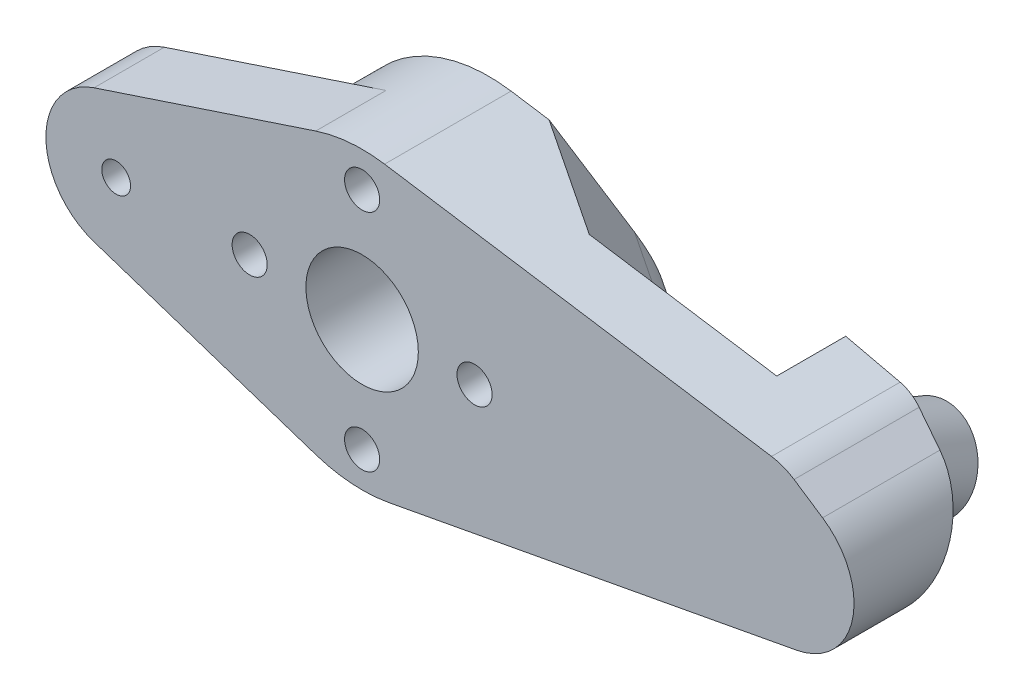
from build123d import *
from OCP.BRepFilletAPI import BRepFilletAPI_MakeChamfer

# Parameters (mm, degrees)
BOSS_EXTRU_1_DEPTH                  = 10
ENL_V_MAT_EXTRU_1_REACH             = 39.885
ESQUISSE2_R                         = 4
ESQUISSE2_R_2                       = 1.25
ENL_V_MAT_EXTRU_2_REACH             = 39.885
ENL_V_MAT_EXTRU_2_DIRECTION_2_REACH = 39.885
BOSS_EXTRU_2_START                  = 2
BOSS_EXTRU_2_DEPTH                  = 2
ENL_V_MAT_EXTRU_3_REACH             = 40.347
ESQUISSE7_R                         = 1.25
ENL_V_MAT_EXTRU_4_DEPTH             = 6
ESQUISSE8_W                         = 13.848155074
ESQUISSE8_H                         = 21.741024256
ENL_V_MAT_EXTRU_5_DEPTH             = 2.4
BOSS_EXTRU_3_START                  = 3
ESQUISSE9_R                         = 3.222512383
ESQUISSE9_R_2                       = 1.25
BOSS_EXTRU_3_DEPTH                  = 3
CHANFREIN1_SIZE                     = 4
CHANFREIN1_SIZE2                    = 4.360122539
CHANFREIN1_SIZE2_2                  = 4.445329843
CONG_1_R                            = 4
ESQUISSE10_R                        = 15.601739672
ENL_V_MAT_EXTRU_6_DEPTH             = 1
BOSS_EXTRU_5_START                  = -5
ESQUISSE13_R                        = 1.025
BOSS_EXTRU_5_DEPTH                  = 5
ENL_V_MAT_EXTRU_7_DEPTH             = 1.5


with BuildPart() as part:
    # Esquisse1 → Boss.-Extru.1 (new body)
    with BuildSketch(Plane.XY):
        with BuildLine():
            Line((30.916666667, -4.915254034), (1.925, -10.322033472))
            ThreePointArc((1.925, -10.322033472), (-10.498702111, -0.165087796), (1.599509013, 10.377454934))
            Line((1.599509013, 10.377454934), (30, 6))
            Line((30, 6), (32.763853992, 4.166666667))
            ThreePointArc((32.763853992, 4.166666667), (34.899681519, -0.996554572), (30.916666667, -4.915254034))
        make_face()
    extrude(amount=BOSS_EXTRU_1_DEPTH)

    # Esquisse2 → Enlèv. mat.-Extru.1 (cut, up to next)
    with BuildSketch(Plane.XY.offset(10), mode=Mode.PRIVATE) as enl_v_mat_extru_1_sk1:
        Circle(ESQUISSE2_R)
    enl_v_mat_extru_1_tool1 = extrude(enl_v_mat_extru_1_sk1.sketch, amount=-ENL_V_MAT_EXTRU_1_REACH, mode=Mode.PRIVATE) & part.part
    # Esquisse2 → Enlèv. mat.-Extru.1 (cut, up to next)
    with BuildSketch(Plane.XY.offset(10), mode=Mode.PRIVATE) as enl_v_mat_extru_1_sk2:
        with Locations((0, 8)):
            Circle(ESQUISSE2_R_2)
    enl_v_mat_extru_1_tool2 = extrude(enl_v_mat_extru_1_sk2.sketch, amount=-ENL_V_MAT_EXTRU_1_REACH, mode=Mode.PRIVATE) & part.part
    # Esquisse2 → Enlèv. mat.-Extru.1 (cut, up to next)
    with BuildSketch(Plane.XY.offset(10), mode=Mode.PRIVATE) as enl_v_mat_extru_1_sk3:
        with Locations((8, 0)):
            Circle(ESQUISSE2_R_2)
    enl_v_mat_extru_1_tool3 = extrude(enl_v_mat_extru_1_sk3.sketch, amount=-ENL_V_MAT_EXTRU_1_REACH, mode=Mode.PRIVATE) & part.part
    # Esquisse2 → Enlèv. mat.-Extru.1 (cut, up to next)
    with BuildSketch(Plane.XY.offset(10), mode=Mode.PRIVATE) as enl_v_mat_extru_1_sk4:
        with Locations((0, -8)):
            Circle(ESQUISSE2_R_2)
    enl_v_mat_extru_1_tool4 = extrude(enl_v_mat_extru_1_sk4.sketch, amount=-ENL_V_MAT_EXTRU_1_REACH, mode=Mode.PRIVATE) & part.part
    # Esquisse2 → Enlèv. mat.-Extru.1 (cut, up to next)
    with BuildSketch(Plane.XY.offset(10), mode=Mode.PRIVATE) as enl_v_mat_extru_1_sk5:
        with Locations((-8, 0)):
            Circle(ESQUISSE2_R_2)
    enl_v_mat_extru_1_tool5 = extrude(enl_v_mat_extru_1_sk5.sketch, amount=-ENL_V_MAT_EXTRU_1_REACH, mode=Mode.PRIVATE) & part.part
    add(enl_v_mat_extru_1_tool1.solids().sort_by_distance((0, 0, 10))[0], mode=Mode.SUBTRACT)
    add(enl_v_mat_extru_1_tool2.solids().sort_by_distance((0, 8, 10))[0], mode=Mode.SUBTRACT)
    add(enl_v_mat_extru_1_tool3.solids().sort_by_distance((8, 0, 10))[0], mode=Mode.SUBTRACT)
    add(enl_v_mat_extru_1_tool4.solids().sort_by_distance((0, -8, 10))[0], mode=Mode.SUBTRACT)
    add(enl_v_mat_extru_1_tool5.solids().sort_by_distance((-8, 0, 10))[0], mode=Mode.SUBTRACT)

    # Enlèv. mat.-Extru.2: up to this plane
    enl_v_mat_extru_2_end = Plane(origin=(30.916666667, -4.915254034, 10), z_dir=(-0.18333333333333338, 0.9830508068705753, 0))
    # Esquisse4 → Enlèv. mat.-Extru.2 (cut, up to the surface)
    with BuildSketch(Plane(origin=(0, 0, 0), x_dir=(1, 0, 0), z_dir=(0, 1, 0)), mode=Mode.PRIVATE) as enl_v_mat_extru_2_sk1:
        Polygon((20, -5.5), (25, -5.5), (25, 0), (11, 0), align=None)
    enl_v_mat_extru_2_tool1 = split(extrude(enl_v_mat_extru_2_sk1.sketch, amount=-ENL_V_MAT_EXTRU_2_REACH, mode=Mode.PRIVATE), bisect_by=enl_v_mat_extru_2_end, keep=Keep.BOTH, mode=Mode.PRIVATE)
    add(enl_v_mat_extru_2_tool1.solids().sort_by_distance((19.894737, 0, 2.315789))[0], mode=Mode.SUBTRACT)

    # Enlèv. mat.-Extru.2 direction 2: up to this plane
    enl_v_mat_extru_2_direction_2_end = Plane(origin=(1.599509013, 10.377454934, 10), z_dir=(-0.15233419172434606, -0.98832904137827, 0))
    # Esquisse4 → Enlèv. mat.-Extru.2 direction 2 (cut, up to the surface)
    with BuildSketch(Plane(origin=(0, 0, 0), x_dir=(1, 0, 0), z_dir=(0, 1, 0)), mode=Mode.PRIVATE) as enl_v_mat_extru_2_direction_2_sk1:
        Polygon((20, -5.5), (25, -5.5), (25, 0), (11, 0), align=None)
    enl_v_mat_extru_2_direction_2_tool1 = split(extrude(enl_v_mat_extru_2_direction_2_sk1.sketch, amount=ENL_V_MAT_EXTRU_2_DIRECTION_2_REACH, mode=Mode.PRIVATE), bisect_by=enl_v_mat_extru_2_direction_2_end, keep=Keep.BOTH, mode=Mode.PRIVATE)
    add(enl_v_mat_extru_2_direction_2_tool1.solids().sort_by_distance((19.894737, 0, 2.315789))[0], mode=Mode.SUBTRACT)

    # Esquisse5 → Boss.-Extru.2 (add)
    with BuildSketch(Plane(origin=(0, 0, 0), x_dir=(-1, 0, 0), z_dir=(0, 0, -1)).offset(BOSS_EXTRU_2_START)):
        with BuildLine():
            Line((-25, -6.018678409), (-25, 6.770665362))
            Line((-25, 6.770665362), (-30, 6))
            Line((-30, 6), (-32.763853992, 4.166666667))
            ThreePointArc((-32.763853992, 4.166666667), (-34.899681519, -0.996554572), (-30.916666667, -4.915254034))
            Line((-30.916666667, -4.915254034), (-25, -6.018678409))
        make_face()
    extrude(amount=-BOSS_EXTRU_2_DEPTH)

    # Esquisse6 → Enlèv. mat.-Extru.3 (cut, up to next)
    with BuildSketch(Plane.ZY.offset(-25), mode=Mode.PRIVATE) as enl_v_mat_extru_3_sk1:
        Polygon((-2, 6.770665362), (3.214027448, -6.018678409), (-2, -6.018678409), align=None)
    enl_v_mat_extru_3_tool1 = extrude(enl_v_mat_extru_3_sk1.sketch, amount=-ENL_V_MAT_EXTRU_3_REACH, mode=Mode.PRIVATE) & part.part
    add(enl_v_mat_extru_3_tool1.solids().sort_by_distance((25, -1.755564, -0.261991))[0], mode=Mode.SUBTRACT)

    # Esquisse7 → Enlèv. mat.-Extru.4 (cut)
    with BuildSketch(Plane(origin=(0, 0.265787595, 0.651943042), x_dir=(-1, 0, 0), z_dir=(0, -0.3775175740026018, -0.9260024197156237))):
        with Locations(Location((-30, 1.25, 0), (0, 0, 90))):
            Circle(ESQUISSE7_R)
    extrude(amount=-ENL_V_MAT_EXTRU_4_DEPTH, mode=Mode.SUBTRACT)

    # Esquisse8 → Enlèv. mat.-Extru.5 (cut)
    with BuildSketch(Plane(origin=(0, 0.265787595, 0.651943042), x_dir=(-1, 0, 0), z_dir=(0, -0.3775175740026018, -0.9260024197156237))):
        with Locations((-31.924077537, 0.043327094)):
            Rectangle(ESQUISSE8_W, ESQUISSE8_H)
    extrude(amount=-ENL_V_MAT_EXTRU_5_DEPTH, mode=Mode.SUBTRACT)

    # Esquisse9 → Boss.-Extru.3 (add)
    with BuildSketch(Plane(origin=(0, 1.171829772, 2.87434885), x_dir=(-1, 0, 0), z_dir=(0, -0.37751757400260183, -0.9260024197156237)).offset(BOSS_EXTRU_3_START)):
        with Locations(Location((-30, 1.25, 0), (0, 0, 125.615228438))):
            Circle(ESQUISSE9_R)
        with Locations(Location((-30, 1.25, 0), (0, 0, 90))):
            Circle(ESQUISSE9_R_2, mode=Mode.SUBTRACT)
    extrude(amount=-BOSS_EXTRU_3_DEPTH)

    # Chanfrein1: one chamfer whose edges measure the first distance from different faces: ONE call of the kernel's chamfer builder (chamfer() names one face for all edges)
    chanfrein1_edges_1 = [part.edges().sort_by_distance(p)[0] for p in [
        (15.5, 8.23492955, 2.75),
    ]]
    chanfrein1_side_1 = [part.faces().sort_by_distance(p)[0] for p in [
        (15.356524745, 0.219956318, 2.662320677),
    ]]
    chanfrein1_edges_2 = [part.edges().sort_by_distance(p)[0] for p in [
        (15.5, -7.790373885, 2.75),
    ]]
    chanfrein1_side_2 = [part.faces().sort_by_distance(p)[0] for p in [
        (13.6786873, -8.13003825, 6.041602489),
    ]]
    chanfrein1 = BRepFilletAPI_MakeChamfer(part.part.solid().wrapped)
    for e in chanfrein1_edges_1:
        chanfrein1.Add(CHANFREIN1_SIZE, CHANFREIN1_SIZE2, e.wrapped, chanfrein1_side_1[0].wrapped)  # the first distance lies on this face
    for e in chanfrein1_edges_2:
        chanfrein1.Add(CHANFREIN1_SIZE, CHANFREIN1_SIZE2_2, e.wrapped, chanfrein1_side_2[0].wrapped)  # the first distance lies on this face
    add(Compound.cast(chanfrein1.Shape()), mode=Mode.REPLACE)

    # Congé1
    cong_1_edges = [part.edges().sort_by_distance(p)[0] for p in [
        (15.5, -3.289111279, 2.75),
        (15.5, 4.200483399, 2.75),
        (30, 6, 5.452987412),
    ]]
    fillet(cong_1_edges, radius=CONG_1_R)

    # Esquisse10 → Enlèv. mat.-Extru.6 (cut)
    with BuildSketch(Plane(origin=(0, 0, 0), x_dir=(-1, 0, 0), z_dir=(0, 0, -1))):
        Circle(ESQUISSE10_R)
    extrude(amount=-ENL_V_MAT_EXTRU_6_DEPTH, mode=Mode.SUBTRACT)

    # Esquisse13 → Boss.-Extru.5 (add)
    with BuildSketch(Plane.XY.offset(10).offset(BOSS_EXTRU_5_START)):
        with BuildLine():
            Line((-3.3, -9.967948636), (-19.071428571, -4.746642207))
            ThreePointArc((-19.071428571, -4.746642207), (-22.5, 0), (-19.071428571, 4.746642207))
            Line((-19.071428571, 4.746642207), (-3.3, 9.967948636))
            ThreePointArc((-3.3, 9.967948636), (-10.5, 0), (-3.3, -9.967948636))
        make_face()
        with Locations((-17.5, 0)):
            Circle(ESQUISSE13_R, mode=Mode.SUBTRACT)
    extrude(amount=BOSS_EXTRU_5_DEPTH)

    # Esquisse14 → Enlèv. mat.-Extru.7 (cut)
    with BuildSketch(Plane(origin=(-3.3, -9.967948636, 0), x_dir=(0.9493284414763515, -0.3142857142857143, 0), z_dir=(-0.3142857142857143, -0.9493284414763515, 0))):
        Polygon((-14.932458463, 9.25), (-14.280415194, 9.25), (-13.481837469, 6.80869391), (-12.677650771, 9.25), (-12.031917598, 9.25), (-11.440170803, 5.75), (-12.076088271, 5.75), (-12.449786187, 7.960637019), (-13.17755061, 5.75), (-13.790331059, 5.75), (-14.513888751, 7.960637019), (-14.886885546, 5.75), (-15.523504136, 5.75), align=None)
        with BuildLine():
            Line((-10.452991316, 8.083333333), (-11.081196444, 8.083333333))
            add(Edge.make_bspline(
                [(-11.081196444, 8.083333333), (-11.078483322, 8.130853728), (-11.073182045, 8.223705726), (-11.052094907, 8.358576225), (-11.023838864, 8.486014017), (-10.986127424, 8.605573308), (-10.938740533, 8.717210656), (-10.882897577, 8.821306638), (-10.817171895, 8.917313186), (-10.742962345, 9.004767303), (-10.661528803, 9.083223199), (-10.574561909, 9.152787125), (-10.480731385, 9.210189525), (-10.381751594, 9.257426387), (-10.277639389, 9.295166444), (-10.167409705, 9.320398727), (-10.05201697, 9.337486275), (-9.973021299, 9.338981504), (-9.932758944, 9.33974359)],
                knots=[0, 0, 0, 0, 1.199038563, 2.342849363, 3.436047546, 4.486744587, 5.497670872, 6.488682221, 7.459191391, 8.424610317, 9.374430501, 10.305433194, 11.225809216, 12.140057399, 13.06607119, 14.010487599, 14.985989317, 16, 16, 16, 16], degree=3))
            add(Edge.make_bspline(
                [(-9.932758944, 9.33974359), (-9.883337474, 9.33820151), (-9.786855184, 9.335191008), (-9.646658763, 9.309510428), (-9.515730635, 9.266555691), (-9.394165971, 9.206536594), (-9.282999674, 9.130288623), (-9.182250177, 9.039375396), (-9.094964306, 8.931889507), (-9.020588643, 8.812303267), (-8.958791357, 8.68567827), (-8.915486392, 8.554742772), (-8.887022505, 8.42297127), (-8.883986656, 8.334243011), (-8.882478495, 8.290164263)],
                knots=[0, 0, 0, 0, 1.075374347, 2.099382735, 3.09057751, 4.06680945, 5.040638231, 6.016817125, 7.011024321, 8.044445721, 9.0776792, 10.070479129, 11.0414456, 12, 12, 12, 12], degree=3))
            add(Edge.make_bspline(
                [(-8.882478495, 8.290164263), (-8.883065693, 8.263502321), (-8.884247578, 8.209838418), (-8.892465378, 8.128631761), (-8.904793703, 8.045913287), (-8.923381813, 7.961753919), (-8.94656271, 7.876130065), (-8.974684488, 7.788785484), (-9.00839946, 7.700215386), (-9.047144991, 7.609422931), (-9.093368508, 7.516113351), (-9.147189369, 7.418887899), (-9.210036101, 7.317832821), (-9.281149594, 7.212377529), (-9.360875231, 7.10268834), (-9.449602205, 6.989095673), (-9.546308589, 6.871199265), (-9.614943831, 6.792392132), (-9.65020686, 6.751903045)],
                knots=[0, 0, 0, 0, 0.728284026, 1.46585585, 2.227944881, 3.01186502, 3.81876927, 4.650621989, 5.517437689, 6.406905708, 7.346299482, 8.360816762, 9.441613733, 10.596154504, 11.834900912, 13.145207542, 14.533280747, 16, 16, 16, 16], degree=3))
            Line((-9.65020686, 6.751903045), (-10.015491316, 6.333333333))
            Line((-10.015491316, 6.333333333), (-8.8376067, 6.333333333))
            Line((-8.8376067, 6.333333333), (-8.8376067, 5.75))
            Line((-8.8376067, 5.75), (-11.170940034, 5.75))
            Line((-11.170940034, 5.75), (-11.170940034, 6.068309295))
            Line((-11.170940034, 6.068309295), (-10.134682021, 7.171173878))
            add(Edge.make_bspline(
                [(-10.134682021, 7.171173878), (-10.104679688, 7.203344781), (-10.046574068, 7.265650278), (-9.963895758, 7.35715253), (-9.889079191, 7.443985982), (-9.823675749, 7.527075237), (-9.764253143, 7.603725216), (-9.713461024, 7.676246247), (-9.670834683, 7.743982712), (-9.624557744, 7.825661059), (-9.580609864, 7.923077022), (-9.540285025, 8.035304206), (-9.515704244, 8.142567547), (-9.512311319, 8.212462646), (-9.510683623, 8.24599359)],
                knots=[0, 0, 0, 0, 1.246127091, 2.413378631, 3.493388633, 4.492180848, 5.408488754, 6.240484944, 6.999099869, 7.674939598, 8.898438119, 10.020720584, 11.050475521, 12, 12, 12, 12], degree=3))
            add(Edge.make_bspline(
                [(-9.510683623, 8.24599359), (-9.511900612, 8.278432191), (-9.514258724, 8.341287182), (-9.540172457, 8.430698073), (-9.580318911, 8.511650506), (-9.636890936, 8.581725534), (-9.705417375, 8.639310831), (-9.784606113, 8.682141156), (-9.873811527, 8.706854058), (-9.936346223, 8.709947231), (-9.968516155, 8.711538462)],
                knots=[0, 0, 0, 0, 1.062038974, 2.057870785, 3.028805853, 4.01125022, 4.991535629, 5.949134679, 6.94496649, 8, 8, 8, 8], degree=3))
            add(Edge.make_bspline(
                [(-9.968516155, 8.711538462), (-9.985135552, 8.710950642), (-10.017853504, 8.709793424), (-10.065946336, 8.702090139), (-10.111710121, 8.688513903), (-10.155654235, 8.670323658), (-10.197309695, 8.646212358), (-10.236571433, 8.616491338), (-10.273853121, 8.581915879), (-10.30898377, 8.542594092), (-10.340957247, 8.498710967), (-10.369355972, 8.450667285), (-10.39283699, 8.39849287), (-10.413510531, 8.342876502), (-10.429454956, 8.283220817), (-10.441064475, 8.219882848), (-10.449890417, 8.152965636), (-10.451938879, 8.106966346), (-10.452991316, 8.083333333)],
                knots=[0, 0, 0, 0, 0.903469896, 1.778625579, 2.63899355, 3.493148037, 4.358286772, 5.247621495, 6.164656832, 7.118446693, 8.109501108, 9.111810964, 10.146451449, 11.215617525, 12.33435995, 13.498009769, 14.714554818, 16, 16, 16, 16], degree=3))
        make_face()
        with BuildLine():
            add(Edge.make_bspline(
                [(-7.917734905, 6.467948718), (-7.892375009, 6.466558296), (-7.842445753, 6.463820795), (-7.770304787, 6.44339111), (-7.705197149, 6.406686271), (-7.646982221, 6.358811171), (-7.597757144, 6.301211032), (-7.562178372, 6.235525117), (-7.540022578, 6.16366212), (-7.537576563, 6.11357578), (-7.536324649, 6.087940705)],
                knots=[0, 0, 0, 0, 1.016957001, 2.002212695, 2.9757545, 3.99499976, 5.013036768, 5.994806404, 6.97370641, 8, 8, 8, 8], degree=3))
            add(Edge.make_bspline(
                [(-7.536324649, 6.087940705), (-7.537568362, 6.062301513), (-7.539998353, 6.012207129), (-7.562331688, 5.940204101), (-7.597703978, 5.873978308), (-7.646986171, 5.815760947), (-7.704956061, 5.766983595), (-7.770454481, 5.730617228), (-7.842308326, 5.70902862), (-7.89235082, 5.706440852), (-7.917734905, 5.705128205)],
                knots=[0, 0, 0, 0, 1.023218912, 1.999186227, 2.986238111, 4.008388923, 5.030539734, 6.0011649, 6.986089706, 8, 8, 8, 8], degree=3))
            add(Edge.make_bspline(
                [(-7.917734905, 5.705128205), (-7.943125005, 5.706430178), (-7.993179357, 5.708996903), (-8.065144894, 5.730799199), (-8.131126874, 5.766740799), (-8.18911133, 5.815820114), (-8.238613693, 5.873772156), (-8.272980316, 5.940413056), (-8.29552168, 6.012179983), (-8.297918452, 6.062292323), (-8.299145162, 6.087940705)],
                knots=[0, 0, 0, 0, 1.013427518, 1.99788335, 2.976245624, 3.997909735, 5.019573847, 6.001765691, 6.977268297, 8, 8, 8, 8], degree=3))
            add(Edge.make_bspline(
                [(-8.299145162, 6.087940705), (-8.297910358, 6.113585131), (-8.295497774, 6.163689738), (-8.273133195, 6.235313756), (-8.238558614, 6.301418305), (-8.189115458, 6.358751881), (-8.130884544, 6.406927172), (-8.065295428, 6.443211633), (-7.993041999, 6.463852746), (-7.943100845, 6.466569058), (-7.917734905, 6.467948718)],
                knots=[0, 0, 0, 0, 1.025808215, 2.00424526, 2.981110158, 3.998665696, 5.017428914, 5.998734231, 6.983523959, 8, 8, 8, 8], degree=3))
        make_face()
        with BuildLine():
            Line((-6.437666796, 9.25), (-4.844016957, 9.25))
            Line((-4.844016957, 9.25), (-4.844016957, 8.666666667))
            Line((-4.844016957, 8.666666667), (-5.939870322, 8.666666667))
            Line((-5.939870322, 8.666666667), (-6.076589072, 8.004807692))
            add(Edge.make_bspline(
                [(-6.076589072, 8.004807692), (-6.057959185, 8.009996351), (-6.021217221, 8.020229452), (-5.965865406, 8.030491957), (-5.912221783, 8.037143787), (-5.877021166, 8.038031053), (-5.859942437, 8.038461538)],
                knots=[0, 0, 0, 0, 1.05461699, 2.079921384, 3.068411212, 4, 4, 4, 4], degree=3))
            add(Edge.make_bspline(
                [(-5.859942437, 8.038461538), (-5.8227261, 8.037608748), (-5.749364499, 8.035927709), (-5.642045787, 8.01996917), (-5.539281781, 7.994834954), (-5.441386949, 7.958988378), (-5.348456922, 7.912333132), (-5.26037905, 7.855893363), (-5.177045233, 7.789569942), (-5.09993583, 7.713321345), (-5.029084489, 7.629598659), (-4.967483289, 7.539043716), (-4.914872021, 7.44294774), (-4.873026836, 7.340713401), (-4.83999905, 7.2329828), (-4.816132433, 7.1196869), (-4.802018911, 7.000691427), (-4.800115789, 6.919509324), (-4.799145162, 6.878104968)],
                knots=[0, 0, 0, 0, 1.01440847, 1.999622559, 2.951875003, 3.895578053, 4.836219714, 5.782137149, 6.743708247, 7.735272588, 8.734977101, 9.730283169, 10.717124674, 11.717316708, 12.737475749, 13.78628267, 14.87096371, 16, 16, 16, 16], degree=3))
            add(Edge.make_bspline(
                [(-4.799145162, 6.878104968), (-4.800331284, 6.836230577), (-4.802671848, 6.753600162), (-4.81794189, 6.632104224), (-4.844893788, 6.515738544), (-4.881914917, 6.404191613), (-4.930687884, 6.298283274), (-4.989344053, 6.196916397), (-5.05887514, 6.100843395), (-5.138598807, 6.011049133), (-5.225268891, 5.928975454), (-5.317552072, 5.856775081), (-5.414800032, 5.796019052), (-5.517015117, 5.746917909), (-5.623610888, 5.708069959), (-5.734619696, 5.679790505), (-5.850581032, 5.66357381), (-5.929303712, 5.661374362), (-5.969317437, 5.66025641)],
                knots=[0, 0, 0, 0, 1.06808661, 2.107647099, 3.116961351, 4.110378221, 5.100014249, 6.085620622, 7.093190682, 8.119403071, 9.144090782, 10.133780668, 11.103064255, 12.062861538, 13.020824475, 13.992378307, 14.979551724, 16, 16, 16, 16], degree=3))
            add(Edge.make_bspline(
                [(-5.969317437, 5.66025641), (-6.005100521, 5.661170964), (-6.07567225, 5.662974655), (-6.179621309, 5.674061093), (-6.279839745, 5.693662018), (-6.375795508, 5.722029632), (-6.468498212, 5.756943689), (-6.556876189, 5.800610316), (-6.64141509, 5.85219804), (-6.721874857, 5.910765386), (-6.796948132, 5.976739229), (-6.865467063, 6.048958967), (-6.927846472, 6.126514305), (-6.982751537, 6.210362042), (-7.030010148, 6.300378295), (-7.071920047, 6.395502204), (-7.10622372, 6.496727166), (-7.123631846, 6.566901933), (-7.132478495, 6.602564103)],
                knots=[0, 0, 0, 0, 1.054957082, 2.080596141, 3.077793124, 4.061112343, 5.027190972, 5.994718051, 6.962465889, 7.943658696, 8.924948258, 9.904494768, 10.875059, 11.855380583, 12.854004648, 13.869083016, 14.917087635, 16, 16, 16, 16], degree=3))
            Line((-7.132478495, 6.602564103), (-6.414529777, 6.602564103))
            add(Edge.make_bspline(
                [(-6.414529777, 6.602564103), (-6.401405657, 6.577851671), (-6.375900428, 6.529825881), (-6.327383843, 6.466064428), (-6.273072607, 6.411691401), (-6.213456635, 6.366175562), (-6.148149655, 6.33207587), (-6.079812801, 6.306216242), (-6.007587587, 6.29127292), (-5.958399028, 6.289404857), (-5.933560226, 6.288461538)],
                knots=[0, 0, 0, 0, 1.104910296, 2.147267069, 3.153527244, 4.136738762, 5.099945312, 6.05603338, 7.018353, 8, 8, 8, 8], degree=3))
            add(Edge.make_bspline(
                [(-5.933560226, 6.288461538), (-5.916247914, 6.289112908), (-5.882185649, 6.290394488), (-5.832000288, 6.297174369), (-5.784096156, 6.310015309), (-5.738117097, 6.327797026), (-5.6939396, 6.349972835), (-5.652196965, 6.37796835), (-5.612162944, 6.410192225), (-5.574447019, 6.447169231), (-5.540287262, 6.488389992), (-5.510332892, 6.532684509), (-5.483549554, 6.579068549), (-5.463710726, 6.629379501), (-5.447464403, 6.682115061), (-5.435499954, 6.73767303), (-5.428349847, 6.796118294), (-5.427687938, 6.836017238), (-5.42735029, 6.856370192)],
                knots=[0, 0, 0, 0, 0.978869489, 1.925942215, 2.855067702, 3.774946051, 4.70828698, 5.642468714, 6.60995405, 7.609372294, 8.622401667, 9.629904756, 10.629323, 11.642352373, 12.678539694, 13.745912462, 14.850161547, 16, 16, 16, 16], degree=3))
            add(Edge.make_bspline(
                [(-5.42735029, 6.856370192), (-5.427742169, 6.876250708), (-5.428504972, 6.914948615), (-5.434815031, 6.971771003), (-5.446103605, 7.025685166), (-5.461484383, 7.077104046), (-5.481173616, 7.125715402), (-5.505235174, 7.171808594), (-5.533771852, 7.215150636), (-5.566936856, 7.254859127), (-5.602303676, 7.291280884), (-5.640299004, 7.323135063), (-5.680580523, 7.34957182), (-5.721896536, 7.372651878), (-5.765896227, 7.389449041), (-5.811590221, 7.401016627), (-5.858930465, 7.409504457), (-5.891220218, 7.410003148), (-5.907618719, 7.41025641)],
                knots=[0, 0, 0, 0, 1.166249705, 2.270133367, 3.348514167, 4.393962215, 5.415026464, 6.420877785, 7.440098956, 8.453121383, 9.451844239, 10.415694839, 11.355045125, 12.27538808, 13.187007209, 14.108269027, 15.039275622, 16, 16, 16, 16], degree=3))
            add(Edge.make_bspline(
                [(-5.907618719, 7.41025641), (-5.925431303, 7.409580522), (-5.961131542, 7.408225896), (-6.014173162, 7.397203668), (-6.066575248, 7.379365569), (-6.118629208, 7.354755084), (-6.169818318, 7.322547724), (-6.221493483, 7.284772184), (-6.271925024, 7.238683712), (-6.303990801, 7.204356913), (-6.320579457, 7.186598558)],
                knots=[0, 0, 0, 0, 0.88288272, 1.769486374, 2.674910571, 3.623812639, 4.617874466, 5.670434592, 6.794841017, 8, 8, 8, 8], degree=3))
            Line((-6.320579457, 7.186598558), (-6.84922529, 7.307892628))
            Line((-6.84922529, 7.307892628), (-6.437666796, 9.25))
        make_face()
    extrude(amount=-ENL_V_MAT_EXTRU_7_DEPTH, mode=Mode.SUBTRACT)


solid = part.part
